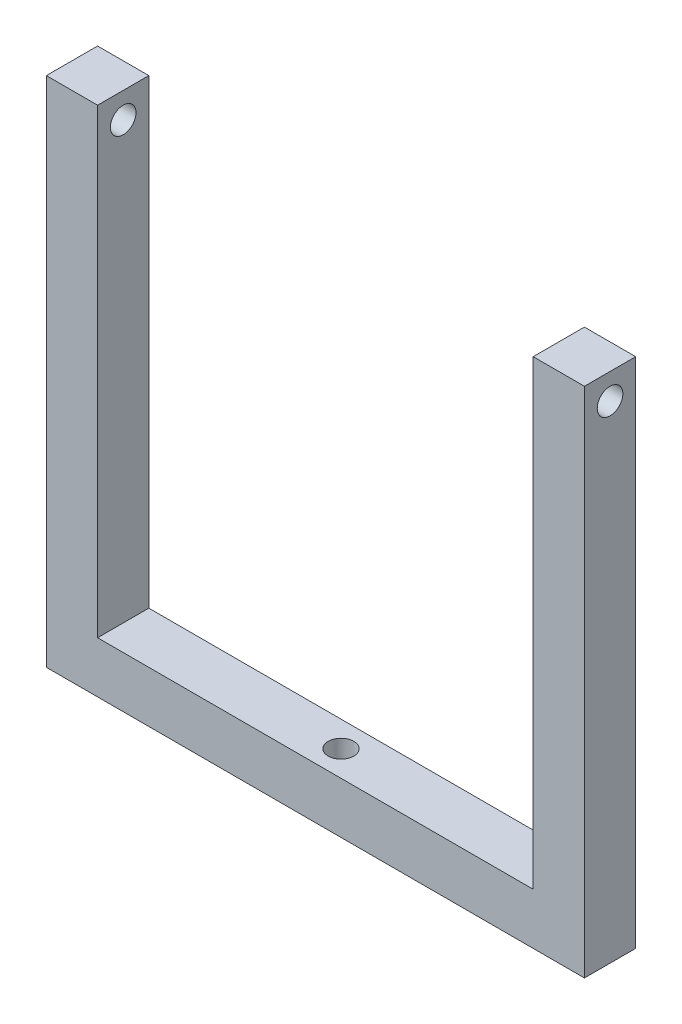
from build123d import *

# Parameters (mm, degrees)
BOSS_EXTRUDE1_DEPTH = 12.7
CUT_EXTRUDE1_REACH  = 186.587
SKETCH2_R           = 3.175
SKETCH3_R           = 3.175
CUT_EXTRUDE2_DEPTH  = 12.7


with BuildPart() as part:
    # Sketch1 → Boss-Extrude1 (new body)
    with BuildSketch(Plane.XY):
        Polygon((0, 0), (-12.7, 0), (-12.7, -127), (120.65, -127), (120.65, 0), (107.95, 0), (107.95, -114.3), (0, -114.3), align=None)
    extrude(amount=BOSS_EXTRUDE1_DEPTH)

    # Cut-Extrude1: up to this face of the body (flat: up to its plane)
    cut_extrude1_end = Plane(part.part.faces().sort_by_distance((120.65, -63.5, 6.35))[0])
    # Sketch2 → Cut-Extrude1 (cut, up to the picked face)
    with BuildSketch(Plane.ZY.offset(12.7), mode=Mode.PRIVATE) as cut_extrude1_sk1:
        with Locations(Location((6.35, -6.35, 0), (0, 0, 270))):
            Circle(SKETCH2_R)
    cut_extrude1_tool1 = split(extrude(cut_extrude1_sk1.sketch, amount=-CUT_EXTRUDE1_REACH, mode=Mode.PRIVATE), bisect_by=cut_extrude1_end, keep=Keep.BOTH, mode=Mode.PRIVATE)
    add(cut_extrude1_tool1.solids().sort_by(Axis((-12.7, -6.35, 6.35), (1, 0, 0)))[0], mode=Mode.SUBTRACT)

    # Sketch3 → Cut-Extrude2 (cut)
    with BuildSketch(Plane(origin=(0, -114.3, 0), x_dir=(1, 0, 0), z_dir=(0, 1, 0))):
        with Locations(Location((53.975, -6.35, 0), (0, 0, 180))):
            Circle(SKETCH3_R)
    extrude(amount=-CUT_EXTRUDE2_DEPTH, mode=Mode.SUBTRACT)


solid = part.part
